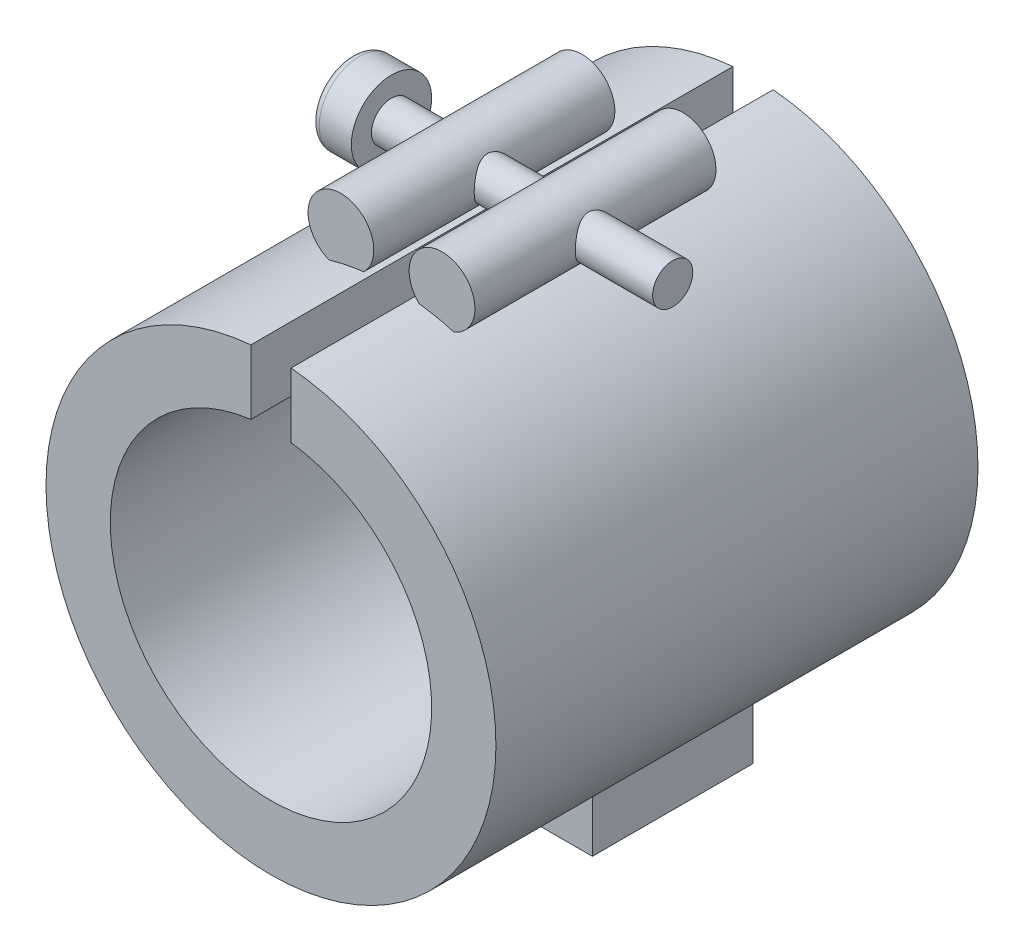
from build123d import *

# Parameters (mm, degrees)
BOSS_EXTRUDE1_DEPTH      = 30
SKETCH2_R                = 4.091242679
BOSS_EXTRUDE2_DEPTH      = 15
SKETCH3_W                = 20
SKETCH3_H                = 12.982921918
BOSS_EXTRUDE3_DEPTH      = 20
BOSS_EXTRUDE5_DEPTH      = 20
BOSS_EXTRUDE5_DEPTH_BACK = 20
SKETCH5_R                = 2.5
SKETCH6_R                = 5
BOSS_EXTRUDE6_DEPTH      = 5
CUT_EXTRUDE1_DEPTH       = 3
FILLET2_R                = 1


with BuildPart() as part:
    # Sketch1 → Boss-Extrude1 (new, symmetric)
    with BuildSketch(Plane.XY):
        with BuildLine():
            Line((-2.5, 27.888169535), (-2.5, 19.843134833))
            ThreePointArc((-2.5, 19.843134833), (0, -20), (2.5, 19.843134833))
            Line((2.5, 19.843134833), (2.5, 27.888169535))
            ThreePointArc((2.5, 27.888169535), (0, -28), (-2.5, 27.888169535))
        make_face()
    extrude(amount=BOSS_EXTRUDE1_DEPTH, both=True)

    # Sketch2 → Boss-Extrude2 (add, symmetric)
    with BuildSketch(Plane.XY):
        with Locations((6.293533022, 30.722501857)):
            Circle(SKETCH2_R)
        with Locations((-6.293533022, 30.722501857)):
            Circle(SKETCH2_R)
    extrude(amount=BOSS_EXTRUDE2_DEPTH, both=True)

    # Sketch3 → Boss-Extrude3 (add)
    with BuildSketch(Plane.XY):
        with Locations((0, -29.508539041)):
            Rectangle(SKETCH3_W, SKETCH3_H)
    extrude(amount=-BOSS_EXTRUDE3_DEPTH)

    # Sketch5 → Boss-Extrude5 (add, two sides: drawn at the far end of the back side and taken through both)
    with BuildSketch(Plane(origin=(0, 0, 0), x_dir=(0, 0, -1), z_dir=(1, 0, 0)).offset(-BOSS_EXTRUDE5_DEPTH_BACK)):
        with Locations((0, 30.722501857)):
            Circle(SKETCH5_R)
    extrude(amount=BOSS_EXTRUDE5_DEPTH + BOSS_EXTRUDE5_DEPTH_BACK)

    # Sketch6 → Boss-Extrude6 (add)
    with BuildSketch(Plane.ZY.offset(20)):
        with Locations((0, 30.722501857)):
            Circle(SKETCH6_R)
    extrude(amount=-BOSS_EXTRUDE6_DEPTH)

    # Sketch7 → Cut-Extrude1 (cut)
    with BuildSketch(Plane.ZY.offset(20)):
        Polygon((1.58771324, 27.972501857), (3.175426481, 30.722501857), (1.58771324, 33.472501857), (-1.58771324, 33.472501857), (-3.175426481, 30.722501857), (-1.58771324, 27.972501857), align=None)
    extrude(amount=-CUT_EXTRUDE1_DEPTH, mode=Mode.SUBTRACT)

    # Fillet2
    fillet2_edges = [part.edges().sort_by_distance(p)[0] for p in [
        (-20, 30.722501857, -5),
    ]]
    fillet(fillet2_edges, radius=FILLET2_R)


solid = part.part
